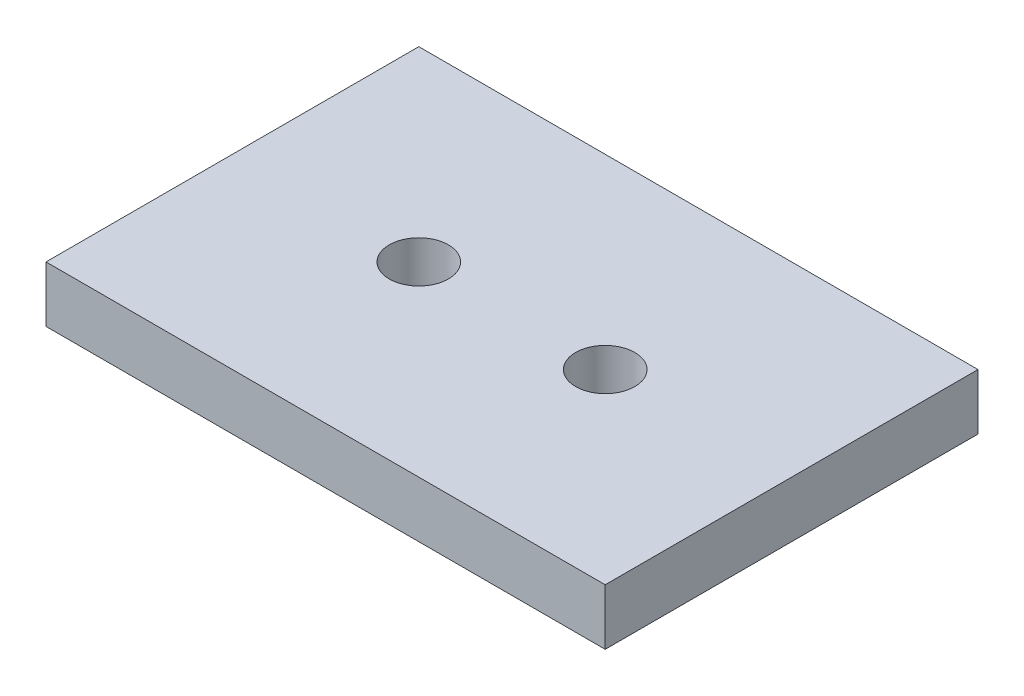
from build123d import *

# Parameters (mm, degrees)
BOSS_EXTRUDE1_DEPTH = 3


with BuildPart() as part:
    # Sketch1 → Boss-Extrude1 (new body)
    with BuildSketch(Plane(origin=(0, 0, 0), x_dir=(1, 0, 0), z_dir=(0, 1, 0))):
        with BuildLine():
            Line((15, 0), (6.5875, 0))
            ThreePointArc((6.5875, 0), (5, -1.5875), (3.4125, 0))
            Line((3.4125, 0), (-3.4125, 0))
            ThreePointArc((-3.4125, 0), (-5, -1.5875), (-6.5875, 0))
            Line((-6.5875, 0), (-15, 0))
            Line((-15, 0), (-15, -10))
            Line((-15, -10), (15, -10))
            Line((15, -10), (15, 0))
        make_face()
        with BuildLine():
            ThreePointArc((3.4125, 0), (5, 1.5875), (6.5875, 0))
            Line((6.5875, 0), (15, 0))
            Line((15, 0), (15, 10))
            Line((15, 10), (-15, 10))
            Line((-15, 10), (-15, 0))
            Line((-15, 0), (-6.5875, 0))
            ThreePointArc((-6.5875, 0), (-5, 1.5875), (-3.4125, 0))
            Line((-3.4125, 0), (3.4125, 0))
        make_face()
    extrude(amount=BOSS_EXTRUDE1_DEPTH)


solid = part.part
